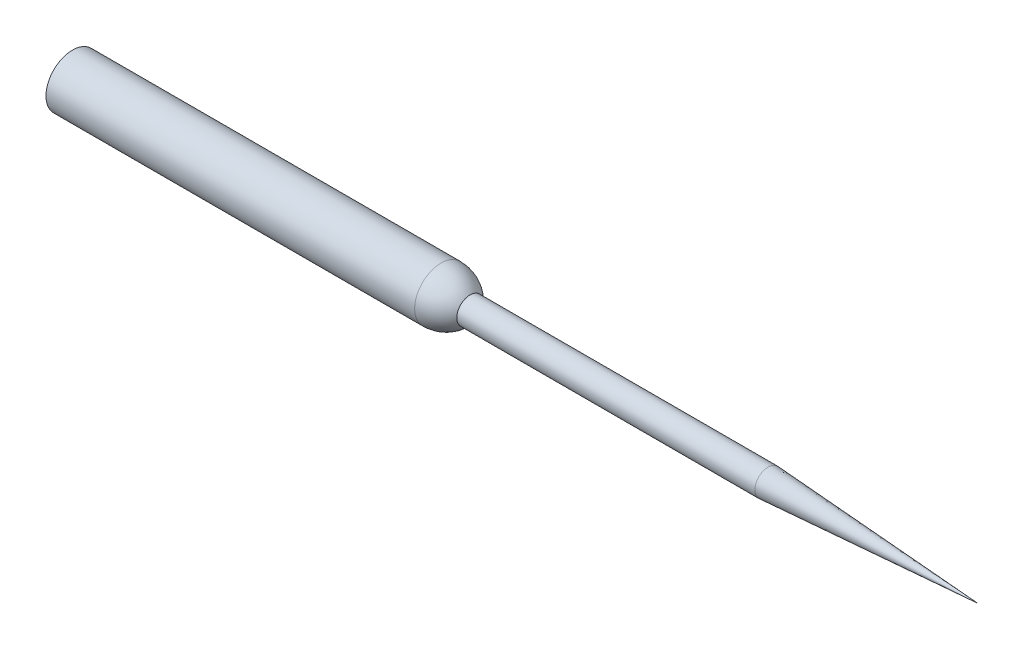
from build123d import *

# Parameters (mm, degrees)
SKETCH1_W    = 46.350636058
SKETCH1_H    = 3.327737973
SCALE1_SCALE = 6


with BuildPart() as part:
    # Sketch1 → Revolve4 (revolve)
    with BuildSketch(Plane.XY, mode=Mode.PRIVATE) as revolve4_sk:
        with Locations((31.732358532, 12.479017401)):
            Rectangle(SKETCH1_W, SKETCH1_H)
        with BuildLine():
            Line((54.907676561, 14.142886387), (54.907676561, 10.815148414))
            Line((54.907676561, 10.815148414), (96.029010089, 10.815148414))
            Line((96.029010089, 10.815148414), (96.029010089, 12.4790174))
            Line((96.029010089, 12.4790174), (58.545897095, 12.4790174))
            ThreePointArc((58.545897095, 12.4790174), (56.907995827, 13.707183992), (54.907676561, 14.142886387))
        make_face()
        Polygon((96.029010089, 12.4790174), (96.029010089, 10.815148414), (122.413218307, 10.815148414), align=None)
    revolve(revolve4_sk.sketch.rotate(Axis((8.557040503, 10.815148414, 0), (1, 0, 0)), 90), axis=Axis((8.557040503, 10.815148414, 0), (1, 0, 0)))


with BuildPart() as part_1:
    # Scale1: scaled about (42.441254063, 10.815148414, 0)
    add(part.part.scale(SCALE1_SCALE).moved(Location((-212.206270315, -54.07574207, 0))))


solid = part_1.part
